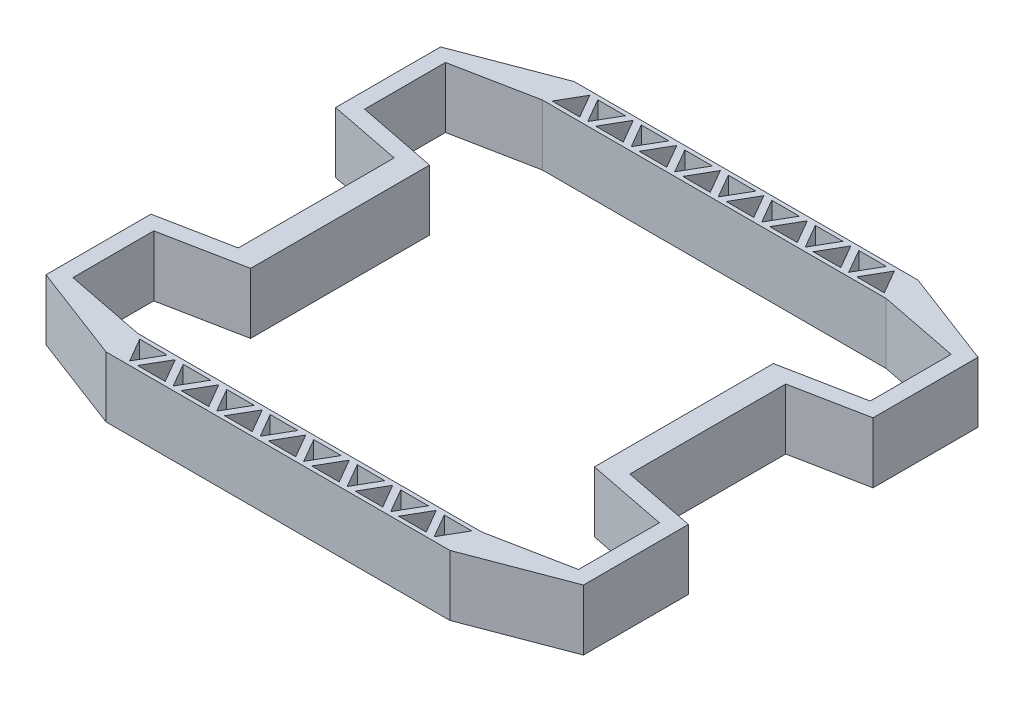
from build123d import *

# Parameters (mm, degrees)
BOSS_EXTRUDE1_DEPTH = 38.1


with BuildPart() as part:
    # Sketch1 → Boss-Extrude1 (new body)
    # profile 1 of 2: a face of its own
    with BuildSketch(Plane(origin=(0, 0, 0), x_dir=(1, 0, 0), z_dir=(0, 1, 0))):
        Polygon((0, 254), (0, 274), (-60.8, 250.891892714), (-60.8, 184.972107286), (-15, 175.951549331), (-15, 127), (0, 127), (0, 183.18932995), (-50.8, 193.194664975), (-50.8, 243.994664975), align=None)
    # profile 2 of 2: a face of its own
    with BuildSketch(Plane(origin=(0, 0, 0), x_dir=(1, 0, 0), z_dir=(0, 1, 0))):
        Polygon((99.289745962, 271.5), (107.95, 271.5), (107.95, 274), (0, 274), (0, 254), (107.95, 254), (107.95, 256.5), align=None)
        Polygon((85.629491924, 256.5), (94.289745962, 271.5), (102.95, 256.5), align=None, mode=Mode.SUBTRACT)
        Polygon((58.308983849, 256.5), (66.969237886, 271.5), (75.629491924, 256.5), align=None, mode=Mode.SUBTRACT)
        Polygon((89.289745962, 271.5), (80.629491924, 256.5), (71.969237886, 271.5), align=None, mode=Mode.SUBTRACT)
        Polygon((30.988475773, 256.5), (39.648729811, 271.5), (48.308983849, 256.5), align=None, mode=Mode.SUBTRACT)
        Polygon((61.969237886, 271.5), (53.308983849, 256.5), (44.648729811, 271.5), align=None, mode=Mode.SUBTRACT)
        Polygon((34.648729811, 271.5), (25.988475773, 256.5), (17.328221735, 271.5), align=None, mode=Mode.SUBTRACT)
        Polygon((12.328221735, 271.5), (20.988475773, 256.5), (3.667967697, 256.5), align=None, mode=Mode.SUBTRACT)
    extrude(amount=BOSS_EXTRUDE1_DEPTH)

    # Mirror1: part across plane


with BuildPart() as part_1:
    add(part.part)
    add(part.part.mirror(Plane(origin=(0, 38.1, -127), x_dir=(1, 0, 0), z_dir=(0, 0, -1))))

    # Mirror2: part across plane


with BuildPart() as part_2:
    add(part_1.part)
    add(part_1.part.mirror(Plane(origin=(107.95, 38.1, -254), x_dir=(0, 0, 1), z_dir=(-1, 0, 0))))


solid = part_2.part
